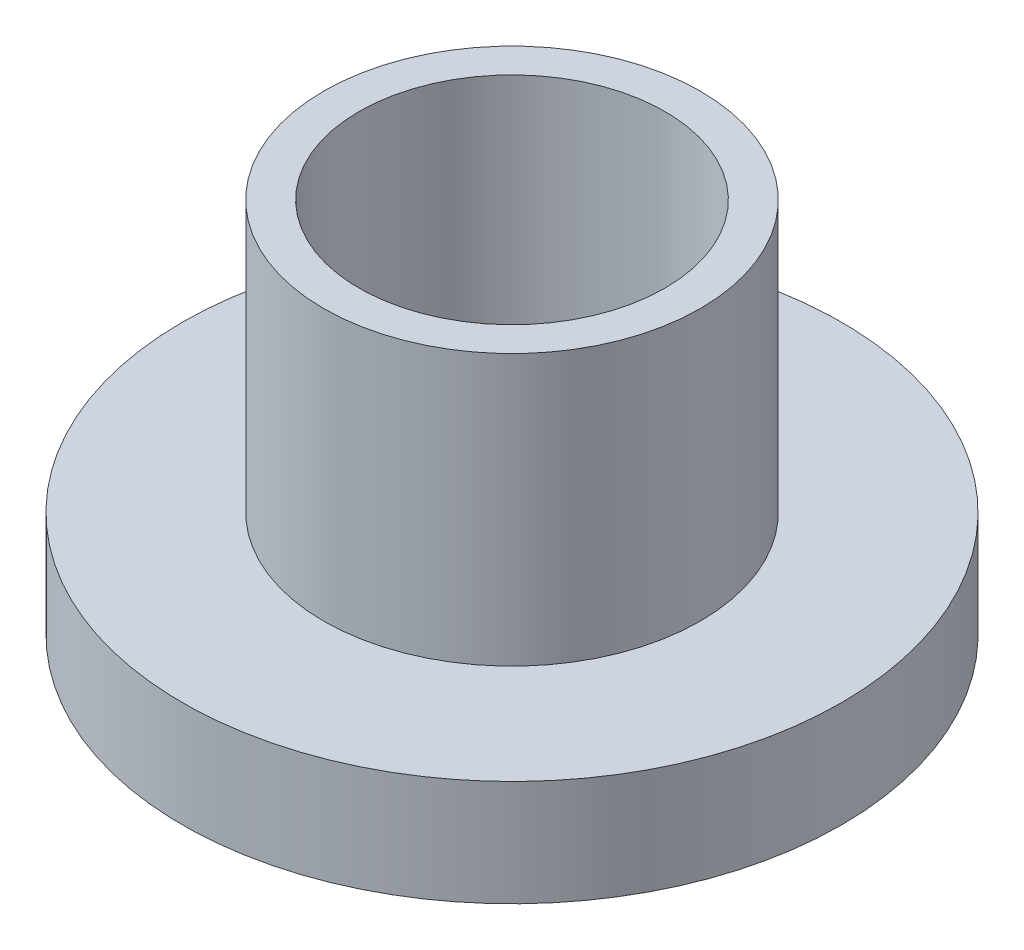
from build123d import *

# Parameters (mm, degrees)
SKETCH1_W   = 3.048
SKETCH1_H   = 2.286
SKETCH1_W_2 = 0.762
SKETCH1_H_2 = 5.842


with BuildPart() as part:
    # Sketch1 → Revolve2 (revolve)
    with BuildSketch(Plane.XY, mode=Mode.PRIVATE) as revolve2_sk:
        with Locations((-5.795925581, -1.654544186)):
            Rectangle(SKETCH1_W, SKETCH1_H)
        with Locations((-3.890925581, -1.654544186)):
            Rectangle(SKETCH1_W_2, SKETCH1_H)
        with Locations((-3.890925581, 2.409455814)):
            Rectangle(SKETCH1_W_2, SKETCH1_H_2)
    revolve(revolve2_sk.sketch.rotate(Axis((-0.207925581, -2.797544186, 0), (0, 1, 0)), 180), axis=Axis((-0.207925581, -2.797544186, 0), (0, 1, 0)))


solid = part.part
